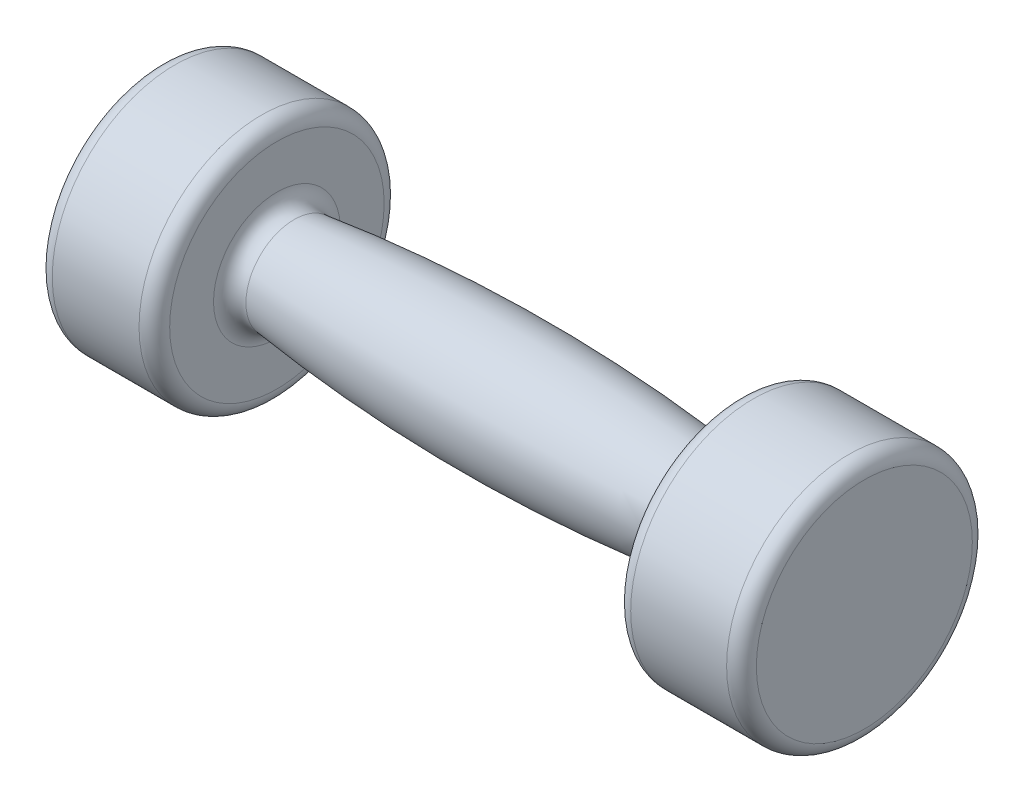
from build123d import *


with BuildPart() as part:
    # Sketch1 → Revolve1 (revolve)
    with BuildSketch(Plane.XY, mode=Mode.PRIVATE) as revolve1_sk:
        with BuildLine():
            Line((-88.281420789, 0), (-88.281420789, -35.247573252))
            ThreePointArc((-88.281420789, -35.247573252), (-86.75779905, -38.619977052), (-83.324132313, -40))
            Line((-83.324132313, -40), (-55.009165386, -40))
            ThreePointArc((-55.009165386, -40), (-51.47363148, -38.535533906), (-50.009165386, -35))
            Line((-50.009165386, -35), (-50.009165386, -20.685907757))
            ThreePointArc((-50.009165386, -20.685907757), (-48.322274172, -16.941136713), (-44.399841316, -15.723174218))
            ThreePointArc((-44.399841316, -15.723174218), (25.089987144, -19.933581913), (94.570071054, -15.565317694))
            ThreePointArc((94.570071054, -15.565317694), (98.459421712, -16.743104421), (100.189534276, -20.42018759))
            Line((100.189534276, -20.42018759), (100.503224158, -35.14869615))
            ThreePointArc((100.503224158, -35.14869615), (101.99144611, -38.585291985), (105.458951949, -40))
            Line((105.458951949, -40), (136.761290735, -40))
            ThreePointArc((136.761290735, -40), (140.194957471, -38.619977052), (141.718579211, -35.247573252))
            Line((141.718579211, -35.247573252), (141.718579211, 0))
            Line((141.718579211, 0), (-88.281420789, 0))
        make_face()
    revolve(revolve1_sk.sketch.rotate(Axis((-88.281420789, 0, 0), (1, 0, 0)), 270), axis=Axis((-88.281420789, 0, 0), (1, 0, 0)))


solid = part.part
